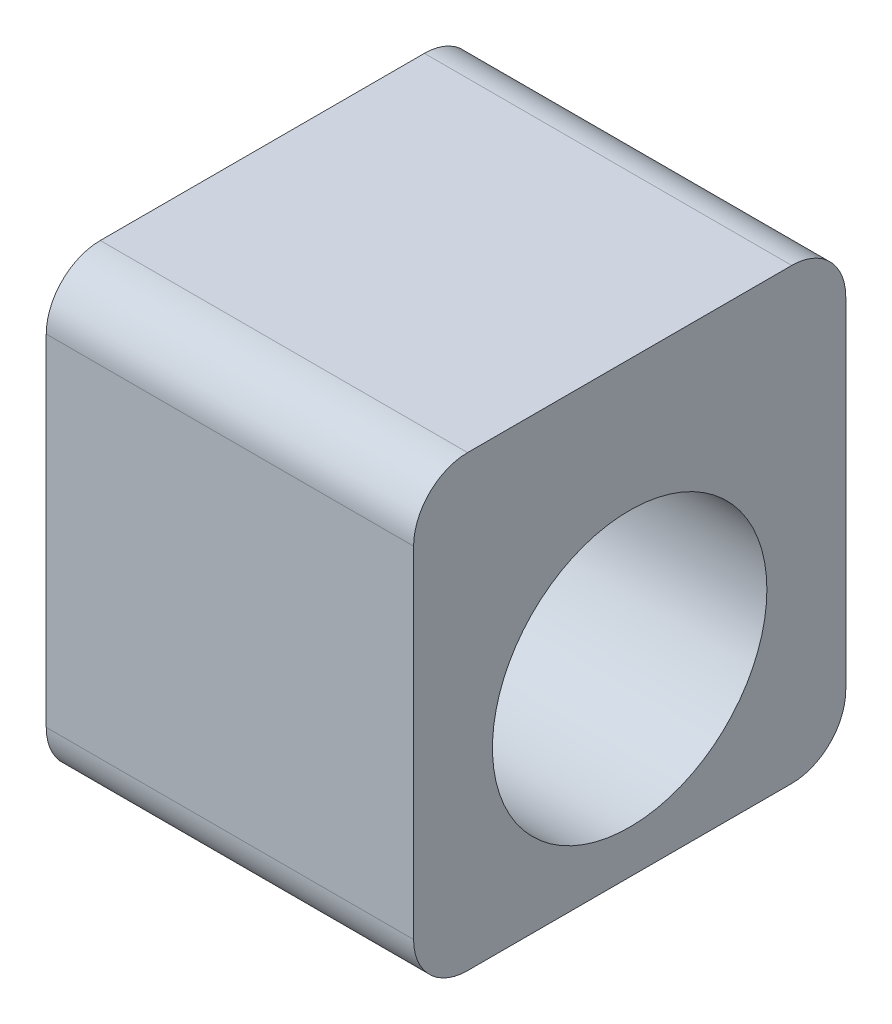
from build123d import *

# Parameters (mm, degrees)
SKETCH1_R           = 12.7
BOSS_EXTRUDE1_DEPTH = 17


with BuildPart() as part:
    # Sketch1 → Boss-Extrude1 (new, symmetric)
    with BuildSketch(Plane(origin=(0, 0, 0), x_dir=(0, 0, -1), z_dir=(1, 0, 0))):
        with BuildLine():
            Line((-15, -16.7), (15, -16.7))
            ThreePointArc((15, -16.7), (18.535533906, -15.235533906), (20, -11.7))
            Line((20, -11.7), (20, 19.826))
            ThreePointArc((20, 19.826), (18.535533906, 23.361533906), (15, 24.826))
            Line((15, 24.826), (-15, 24.826))
            ThreePointArc((-15, 24.826), (-18.535533906, 23.361533906), (-20, 19.826))
            Line((-20, 19.826), (-20, -11.7))
            ThreePointArc((-20, -11.7), (-18.535533906, -15.235533906), (-15, -16.7))
        make_face()
        Circle(SKETCH1_R, mode=Mode.SUBTRACT)
    extrude(amount=BOSS_EXTRUDE1_DEPTH, both=True)


solid = part.part
